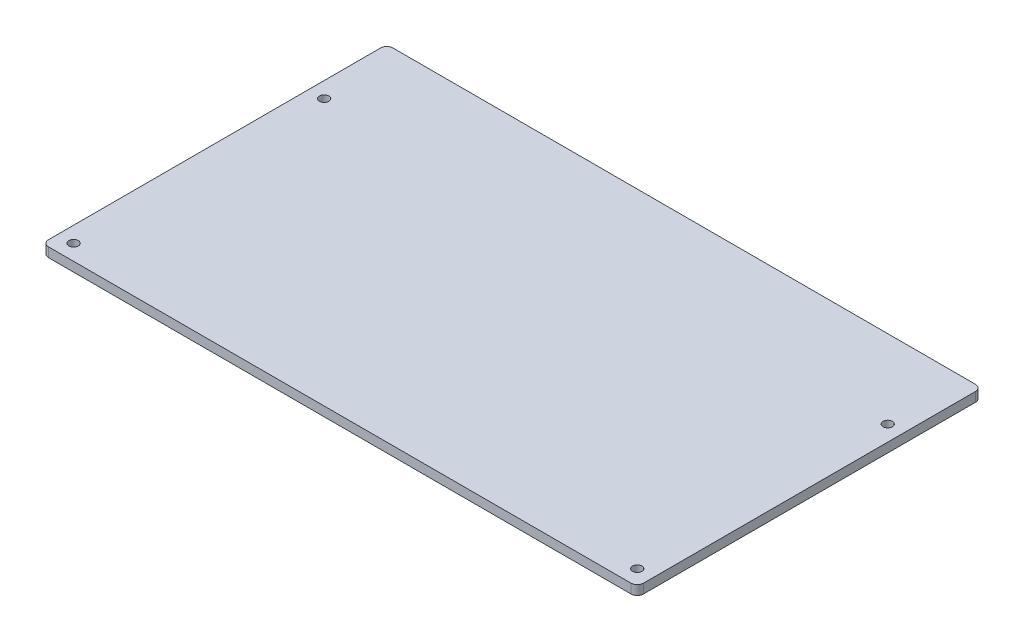
from build123d import *

# Parameters (mm, degrees)
SKETCH1_W           = 190
SKETCH1_H           = 110
BOSS_EXTRUDE1_DEPTH = 3
SKETCH2_R           = 1.5
CUT_EXTRUDE1_DEPTH  = 110.813478226
FILLET1_R           = 2


with BuildPart() as part:
    # Sketch1 → Boss-Extrude1 (new body)
    with BuildSketch(Plane(origin=(0, 0, 0), x_dir=(1, 0, 0), z_dir=(0, 1, 0))):
        Rectangle(SKETCH1_W, SKETCH1_H)
    extrude(amount=BOSS_EXTRUDE1_DEPTH)

    # Sketch2 → Cut-Extrude1 (cut, through all)
    with BuildSketch(Plane(origin=(0, 3, 0), x_dir=(1, 0, 0), z_dir=(0, 1, 0))):
        with Locations(Location((-90, -50, 0), (0, 0, 270))):
            Circle(SKETCH2_R)
        with Locations(Location((-90, 30, 0), (0, 0, 270))):
            Circle(SKETCH2_R)
        with Locations(Location((90, 30, 0), (0, 0, 270))):
            Circle(SKETCH2_R)
        with Locations(Location((90, -50, 0), (0, 0, 270))):
            Circle(SKETCH2_R)
    extrude(amount=-CUT_EXTRUDE1_DEPTH, mode=Mode.SUBTRACT)

    # Fillet1
    fillet1_edges = [part.edges().sort_by_distance(p)[0] for p in [
        (-95, 1.5, -55),
        (95, 1.5, -55),
        (95, 1.5, 55),
        (-95, 1.5, 55),
    ]]
    fillet(fillet1_edges, radius=FILLET1_R)


solid = part.part
